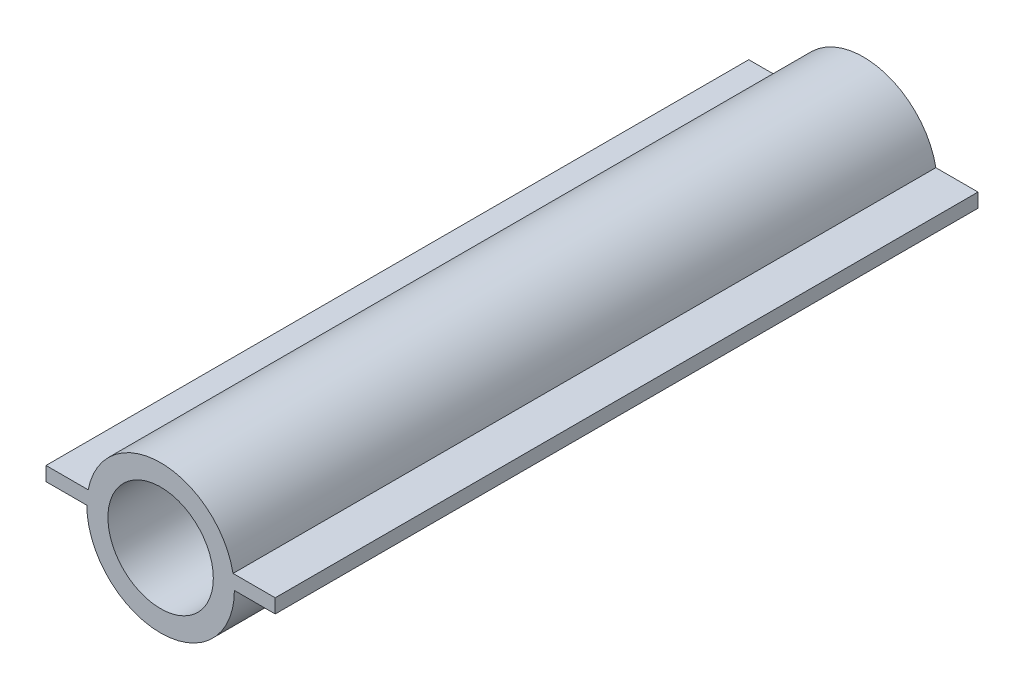
from build123d import *

# Parameters (mm, degrees)
SKETCH2_R           = 3.75
BOSS_EXTRUDE1_DEPTH = 50


with BuildPart() as part:
    # Sketch2 → Boss-Extrude1 (new body)
    with BuildSketch(Plane.XY):
        with BuildLine():
            Line((-8.153882032, 0), (-5.25, 0))
            ThreePointArc((-5.25, 0), (0, -5.25), (5.25, 0))
            Line((5.25, 0), (8.153882032, 0))
            Line((8.153882032, 0), (8.153882032, 1))
            Line((8.153882032, 1), (5.153882032, 1))
            ThreePointArc((5.153882032, 1), (0, 5.25), (-5.153882032, 1))
            Line((-5.153882032, 1), (-8.153882032, 1))
            Line((-8.153882032, 1), (-8.153882032, 0))
        make_face()
        Circle(SKETCH2_R, mode=Mode.SUBTRACT)
    extrude(amount=BOSS_EXTRUDE1_DEPTH)


solid = part.part
